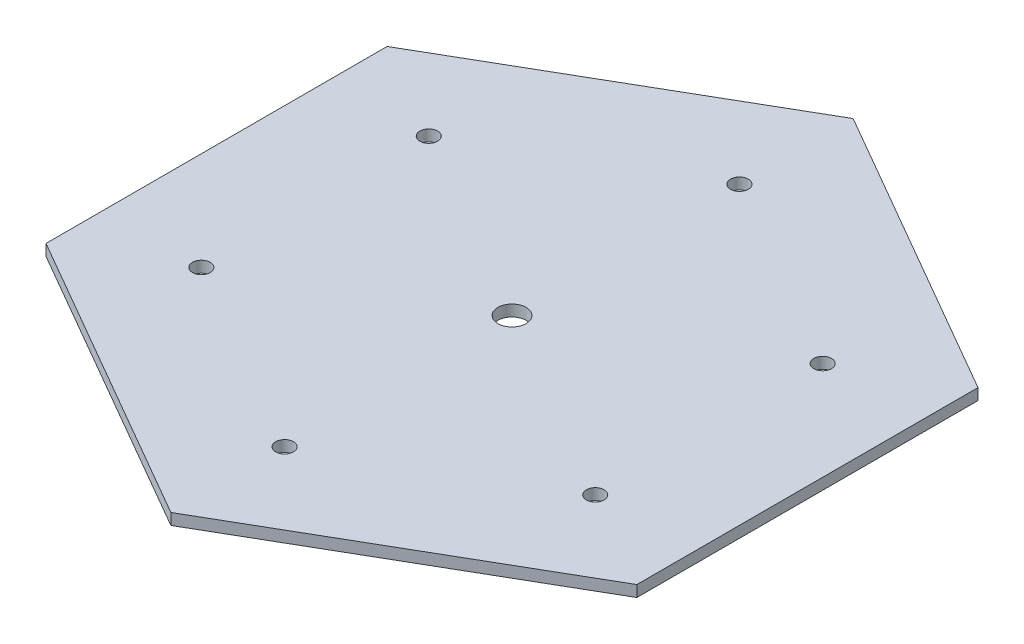
from build123d import *

# Parameters (mm, degrees)
SKETCH2_R           = 2.5
SKETCH2_R_2         = 3.96875
BOSS_EXTRUDE1_DEPTH = 3.175


with BuildPart() as part:
    # Sketch2 → Boss-Extrude1 (new body)
    with BuildSketch(Plane(origin=(0, 0, 0), x_dir=(1, 0, 0), z_dir=(0, 1, 0))):
        Polygon((0, 96.200411253), (-41.656, 72.15030844), (-83.312, 48.100205627), (-83.312, -48.100205627), (0, -96.200411253), (83.312, -48.100205627), (83.312, 48.100205627), align=None)
        with Locations((-55.541333303, -32.066803734)):
            Circle(SKETCH2_R, mode=Mode.SUBTRACT)
        with Locations((0, -64.133607467)):
            Circle(SKETCH2_R, mode=Mode.SUBTRACT)
        with Locations((55.541333303, -32.066803734)):
            Circle(SKETCH2_R, mode=Mode.SUBTRACT)
        with Locations((-55.541333303, 32.066803734)):
            Circle(SKETCH2_R, mode=Mode.SUBTRACT)
        Circle(SKETCH2_R_2, mode=Mode.SUBTRACT)
        with Locations((0, 64.133607467)):
            Circle(SKETCH2_R, mode=Mode.SUBTRACT)
        with Locations((55.541333303, 32.066803734)):
            Circle(SKETCH2_R, mode=Mode.SUBTRACT)
    extrude(amount=BOSS_EXTRUDE1_DEPTH)


solid = part.part
